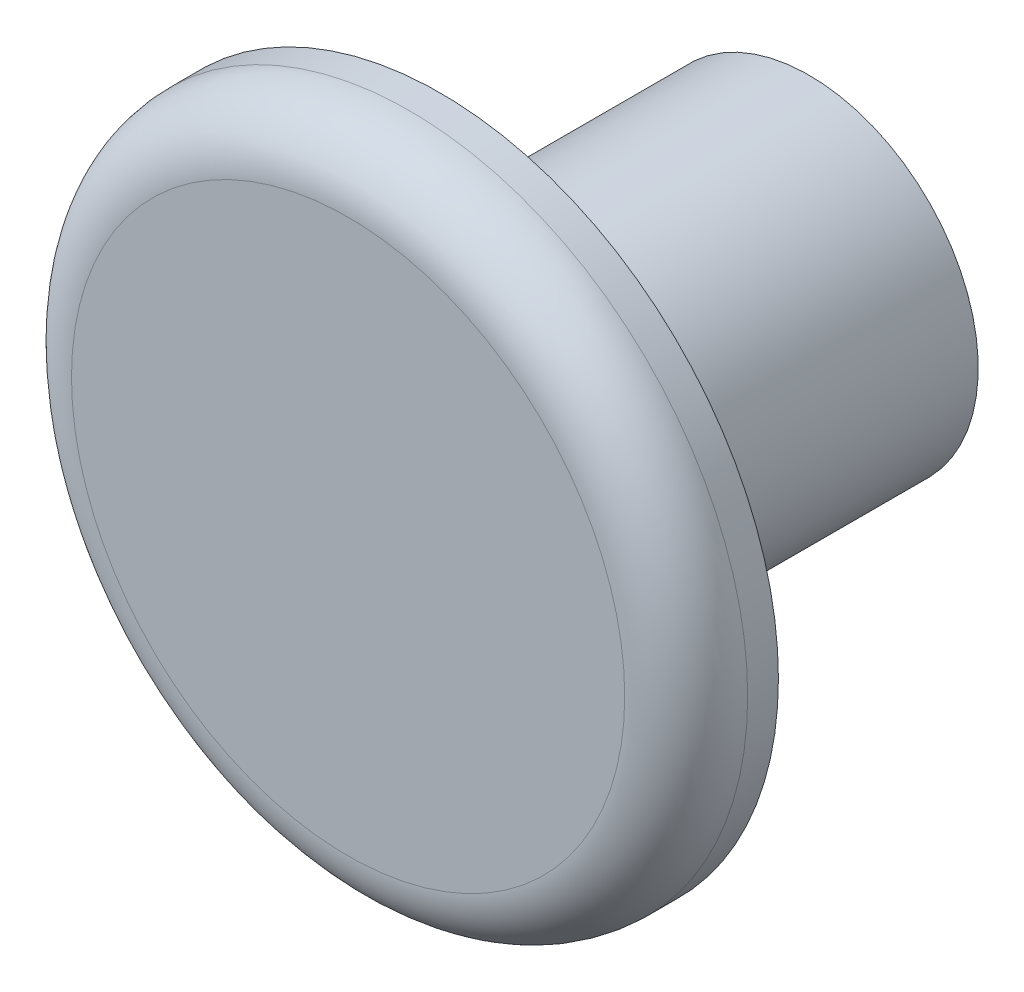
from build123d import *

# Parameters (mm, degrees)
FILLET1_R = 2


with BuildPart() as part:
    # Sketch1 → Revolve1 (revolve)
    with BuildSketch(Plane.YZ, mode=Mode.PRIVATE) as revolve1_sk:
        Polygon((0, -12), (-5.5, -12), (-5.5, 0), (-11, 0), (-11, 3), (0, 3), align=None)
    revolve(revolve1_sk.sketch.rotate(Axis((0, 0, 0), (0, 0, 1)), 270), axis=Axis((0, 0, 0), (0, 0, 1)))

    # Fillet1
    fillet1_edges = [part.edges().sort_by_distance(p)[0] for p in [
        (11, 0, 3),
    ]]
    fillet(fillet1_edges, radius=FILLET1_R)


solid = part.part
